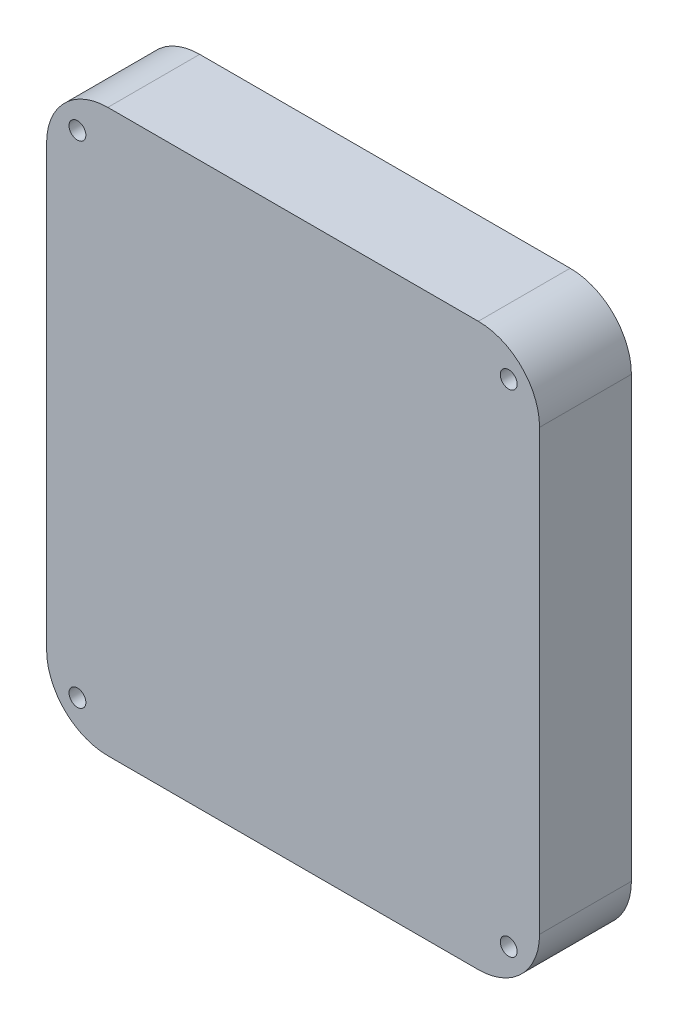
from build123d import *

# Parameters (mm, degrees)
SKIZZE1_W                       = 80.5
SKIZZE1_H                       = 91.7
AUFSATZ_LINEAR_AUSTRAGEN1_DEPTH = 15
VERRUNDUNG1_R                   = 10
SKIZZE2_R                       = 1.375
SCHNITT_LINEAR_AUSTRAGEN1_DEPTH = 63.827422357


with BuildPart() as part:
    # Skizze1 → Aufsatz-Linear austragen1 (new body)
    with BuildSketch(Plane.XY):
        Rectangle(SKIZZE1_W, SKIZZE1_H)
    extrude(amount=AUFSATZ_LINEAR_AUSTRAGEN1_DEPTH)

    # Verrundung1
    verrundung1_edges = [part.edges().sort_by_distance(p)[0] for p in [
        (40.25, -45.85, 7.5),
        (-40.25, -45.85, 7.5),
        (-40.25, 45.85, 7.5),
        (40.25, 45.85, 7.5),
    ]]
    fillet(verrundung1_edges, radius=VERRUNDUNG1_R)

    # Skizze2 → Schnitt-Linear austragen1 (cut, through all)
    with BuildSketch(Plane.XY.offset(15)):
        with Locations((-35.212670401, 40.111824544)):
            Circle(SKIZZE2_R)
        with Locations((35.212670401, 40.111824544)):
            Circle(SKIZZE2_R)
        with Locations((35.212670401, -40.111824544)):
            Circle(SKIZZE2_R)
        with Locations((-35.212670401, -40.111824544)):
            Circle(SKIZZE2_R)
    extrude(amount=-SCHNITT_LINEAR_AUSTRAGEN1_DEPTH, mode=Mode.SUBTRACT)


solid = part.part
